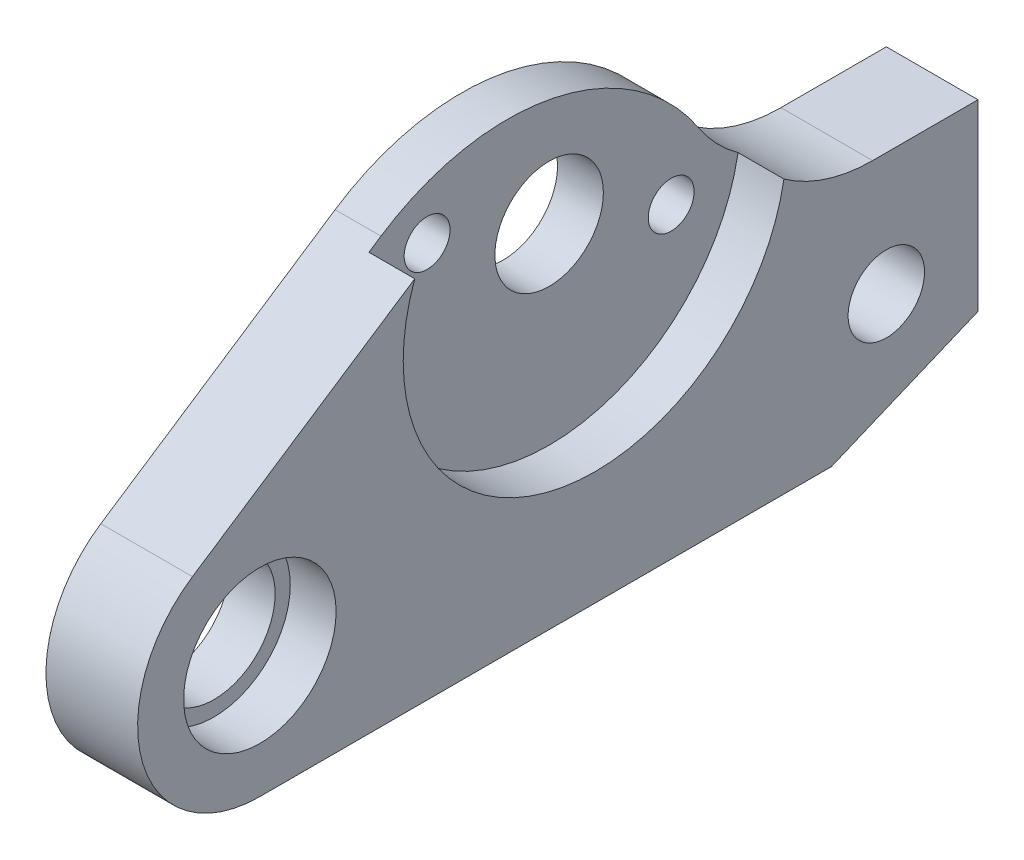
from build123d import *

# Parameters (mm, degrees)
SKETCH1_R           = 3.55
SKETCH1_R_2         = 4
SKETCH1_R_3         = 2.5
SKETCH1_R_4         = 1.5
BOSS_EXTRUDE1_DEPTH = 6
SKETCH2_R           = 4.99
CUT_EXTRUDE1_DEPTH  = 3
SKETCH3_R           = 12.55
CUT_EXTRUDE2_DEPTH  = 3


with BuildPart() as part:
    # Sketch1 → Boss-Extrude1 (new body)
    with BuildSketch(Plane(origin=(0, 0, 0), x_dir=(0, 0, -1), z_dir=(1, 0, 0))):
        with BuildLine():
            Line((-4.410283071, 6.674533934), (10.924994259, 16.807513206))
            ThreePointArc((10.924994259, 16.807513206), (22.222626062, 18.983884909), (31.738603868, 12.517104832))
            ThreePointArc((31.738603868, 12.517104832), (35.34906679, 9.201450356), (40.101489768, 8))
            Line((40.101489768, 8), (47, 8))
            Line((47, 8), (47, -4))
            Line((47, -4), (37.4, -8))
            Line((37.4, -8), (0, -8))
            ThreePointArc((0, -8), (-7.66147086, -2.302577744), (-4.410283071, 6.674533934))
        make_face()
        with Locations((21.931712199, 12)):
            Circle(SKETCH1_R, mode=Mode.SUBTRACT)
        Circle(SKETCH1_R_2, mode=Mode.SUBTRACT)
        with Locations((41, 0)):
            Circle(SKETCH1_R_3, mode=Mode.SUBTRACT)
        with Locations((29.919099476, 9.092828782)):
            Circle(SKETCH1_R_4, mode=Mode.SUBTRACT)
        with Locations((13.944324923, 14.907171218)):
            Circle(SKETCH1_R_4, mode=Mode.SUBTRACT)
    extrude(amount=BOSS_EXTRUDE1_DEPTH)

    # Sketch2 → Cut-Extrude1 (cut)
    with BuildSketch(Plane(origin=(6, 0, 0), x_dir=(0, 0, -1), z_dir=(1, 0, 0))):
        Circle(SKETCH2_R)
    extrude(amount=-CUT_EXTRUDE1_DEPTH, mode=Mode.SUBTRACT)

    # Sketch3 → Cut-Extrude2 (cut)
    with BuildSketch(Plane(origin=(6, 0, 0), x_dir=(0, 0, -1), z_dir=(1, 0, 0))):
        with Locations((21.931712199, 12)):
            Circle(SKETCH3_R)
    extrude(amount=-CUT_EXTRUDE2_DEPTH, mode=Mode.SUBTRACT)


solid = part.part
